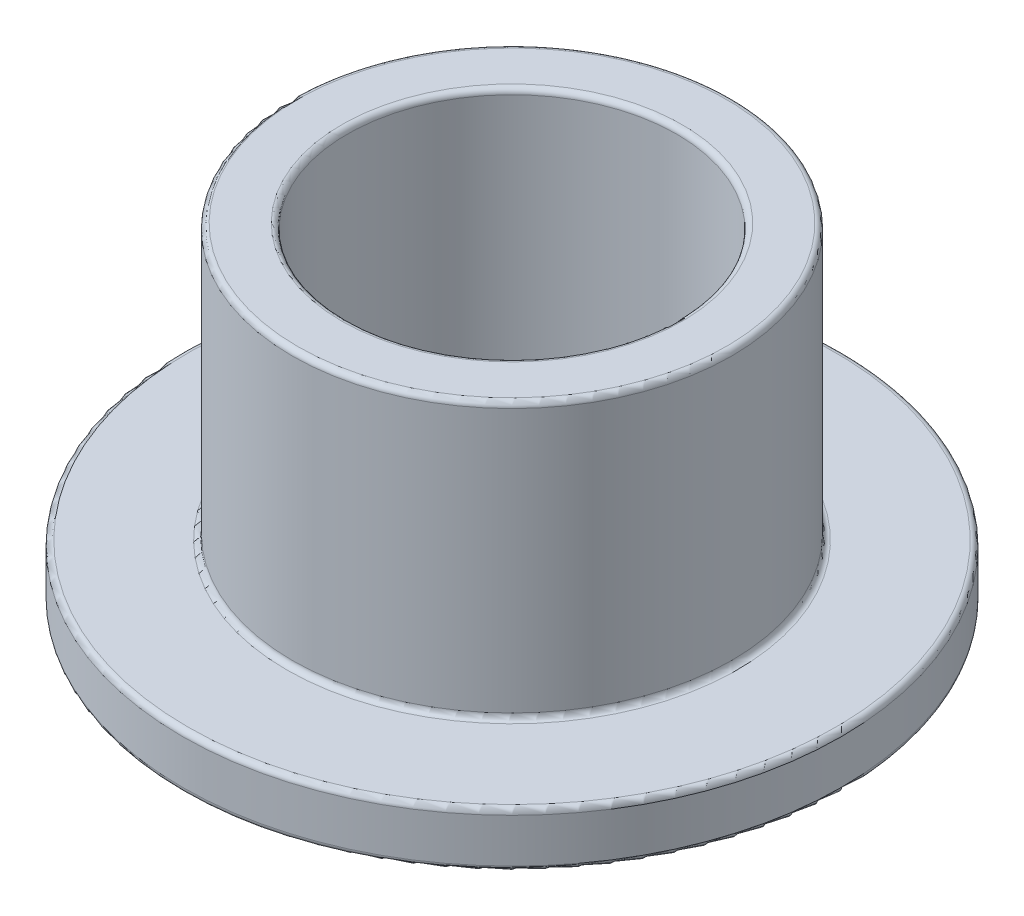
from build123d import *

# Parameters (mm, degrees)
SKETCH3_R           = 4
SKETCH3_R_2         = 3
BOSS_EXTRUDE1_DEPTH = 6
SKETCH4_R           = 6
SKETCH4_R_2         = 4
BOSS_EXTRUDE2_DEPTH = 1
FILLET1_R           = 0.1


with BuildPart() as part:
    # Sketch3 → Boss-Extrude1 (new body)
    with BuildSketch(Plane(origin=(0, 0, 0), x_dir=(1, 0, 0), z_dir=(0, 1, 0))):
        with Locations(Location((0, 0, 0), (0, 0, 270))):
            Circle(SKETCH3_R)
        with Locations(Location((0, 0, 0), (0, 0, 270))):
            Circle(SKETCH3_R_2, mode=Mode.SUBTRACT)
    extrude(amount=BOSS_EXTRUDE1_DEPTH)

    # Sketch4 → Boss-Extrude2 (add)
    with BuildSketch(Plane(origin=(0, 0, 0), x_dir=(1, 0, 0), z_dir=(0, 1, 0))):
        with Locations(Location((0, 0, 0), (0, 0, 270))):
            Circle(SKETCH4_R)
        with Locations(Location((0, 0, 0), (0, 0, 270))):
            Circle(SKETCH4_R_2, mode=Mode.SUBTRACT)
    extrude(amount=BOSS_EXTRUDE2_DEPTH)

    # Fillet1
    fillet1_edges = [part.edges().sort_by_distance(p)[0] for p in [
        (0, 0, -6),
        (0, 1, -4),
        (0, 6, -4),
        (0, 0, -3),
        (0, 6, -3),
        (0, 1, -6),
    ]]
    fillet(fillet1_edges, radius=FILLET1_R)


solid = part.part
